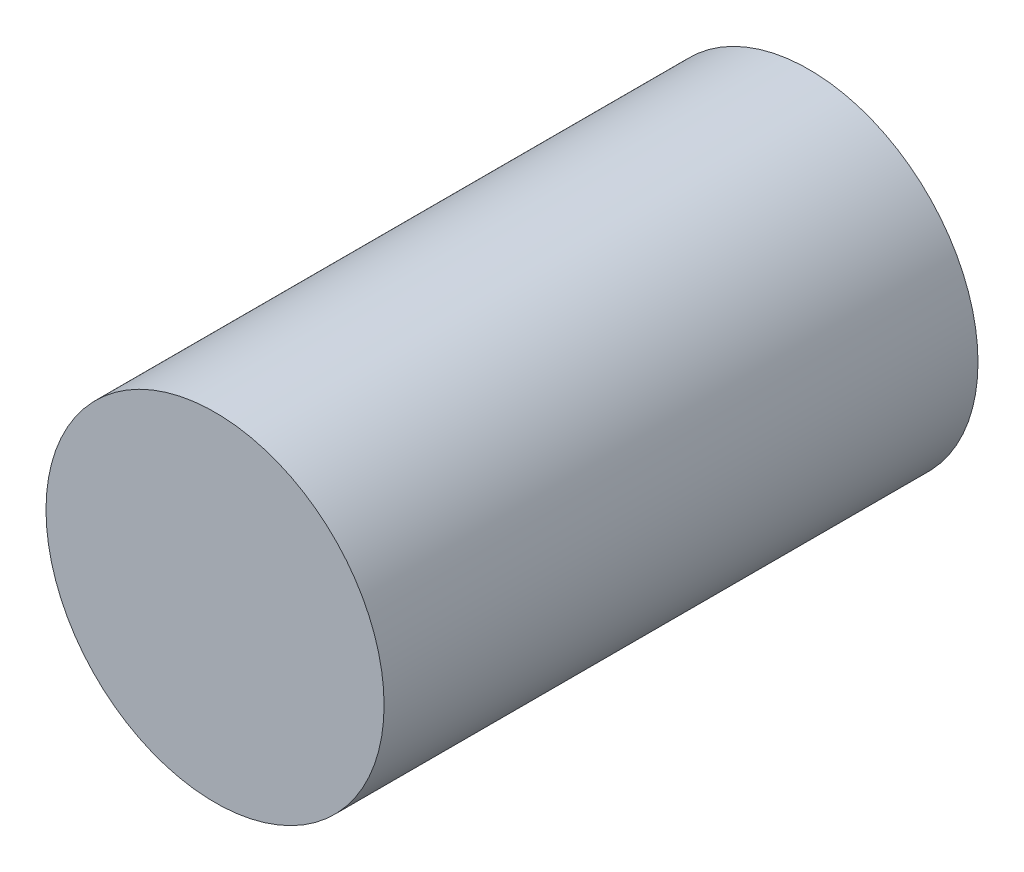
from build123d import *

# Parameters (mm, degrees)
SKETCH_1_R      = 18.5
EXTRUDE_1_DEPTH = 65


with BuildPart() as part:
    # 草圖1 → 伸長1 (new body)
    with BuildSketch(Plane.XY):
        Circle(SKETCH_1_R)
    extrude(amount=EXTRUDE_1_DEPTH)


solid = part.part
